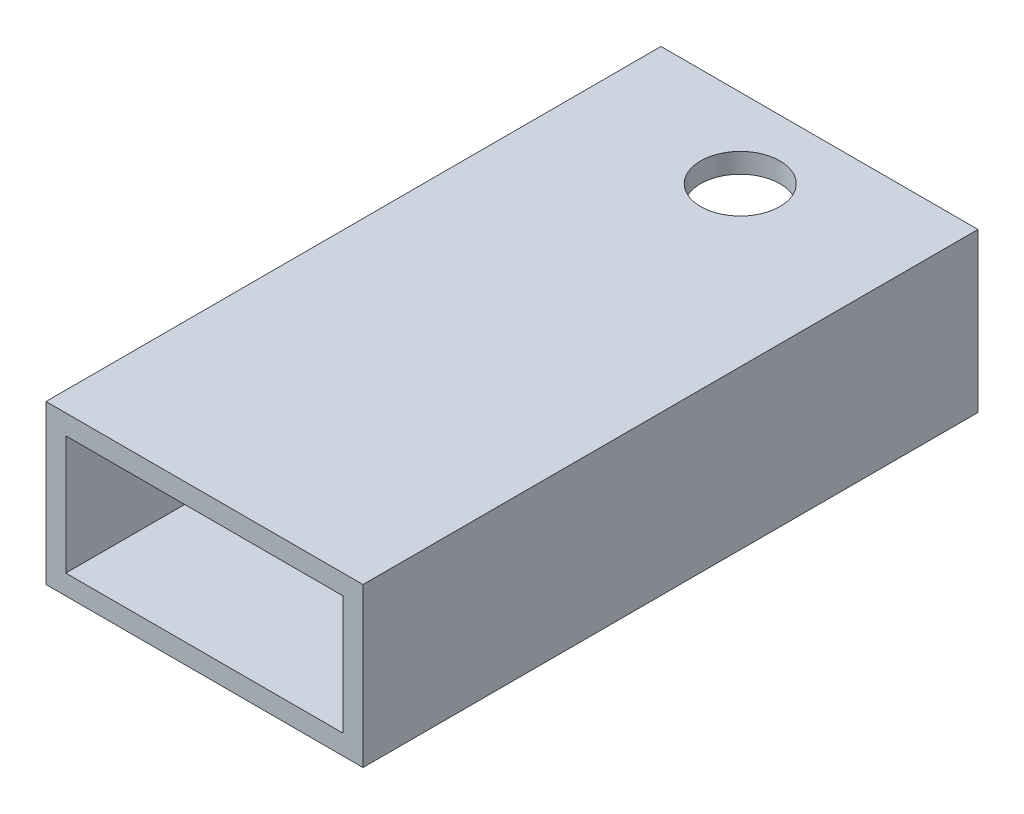
from build123d import *

# Parameters (mm, degrees)
SKETCH1_W           = 50.8
SKETCH1_H           = 25.4
SKETCH1_W_2         = 44.45
SKETCH1_H_2         = 19.05
BOSS_EXTRUDE1_DEPTH = 98.552
SKETCH2_R           = 6.35
CUT_EXTRUDE1_DEPTH  = 114.746633814


with BuildPart() as part:
    # Sketch1 → Boss-Extrude1 (new body)
    with BuildSketch(Plane.XY):
        with Locations((25.4, 12.7)):
            Rectangle(SKETCH1_W, SKETCH1_H)
        with Locations((25.4, 12.7)):
            Rectangle(SKETCH1_W_2, SKETCH1_H_2, mode=Mode.SUBTRACT)
    extrude(amount=BOSS_EXTRUDE1_DEPTH)

    # Sketch2 → Cut-Extrude1 (cut, through all)
    with BuildSketch(Plane.XZ):
        with Locations(Location((25.4, 12.7, 0), (0, 0, 270))):
            Circle(SKETCH2_R)
    extrude(amount=-CUT_EXTRUDE1_DEPTH, mode=Mode.SUBTRACT)


solid = part.part
